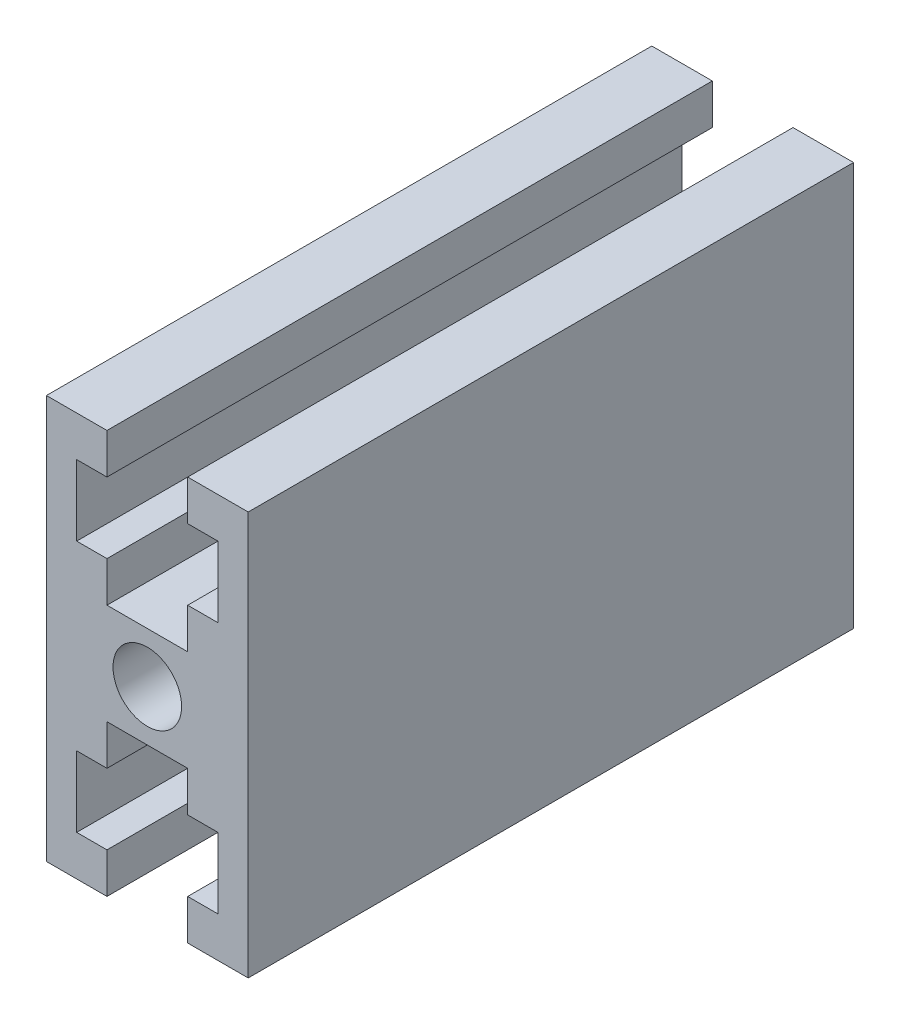
from build123d import *

# Parameters (mm, degrees)
SKETCH_2_R      = 3.4
EXTRUDE_1_DEPTH = 60


with BuildPart() as part:
    # 草图2 → 凸台-拉伸1 (new body)
    with BuildSketch(Plane.XY):
        Polygon((0, 0), (6, 0), (6, -4), (3, -4), (3, -11), (6, -11), (6, -15), (14, -15), (14, -11), (17, -11), (17, -4), (14, -4), (14, 0), (20, 0), (20, -40), (14, -40), (14, -36), (17, -36), (17, -29), (14, -29), (14, -25), (6, -25), (6, -29), (3, -29), (3, -36), (6, -36), (6, -40), (0, -40), align=None)
        with Locations(Location((10, -20, 0), (0, 0, 180))):
            Circle(SKETCH_2_R, mode=Mode.SUBTRACT)
    extrude(amount=EXTRUDE_1_DEPTH)


solid = part.part
